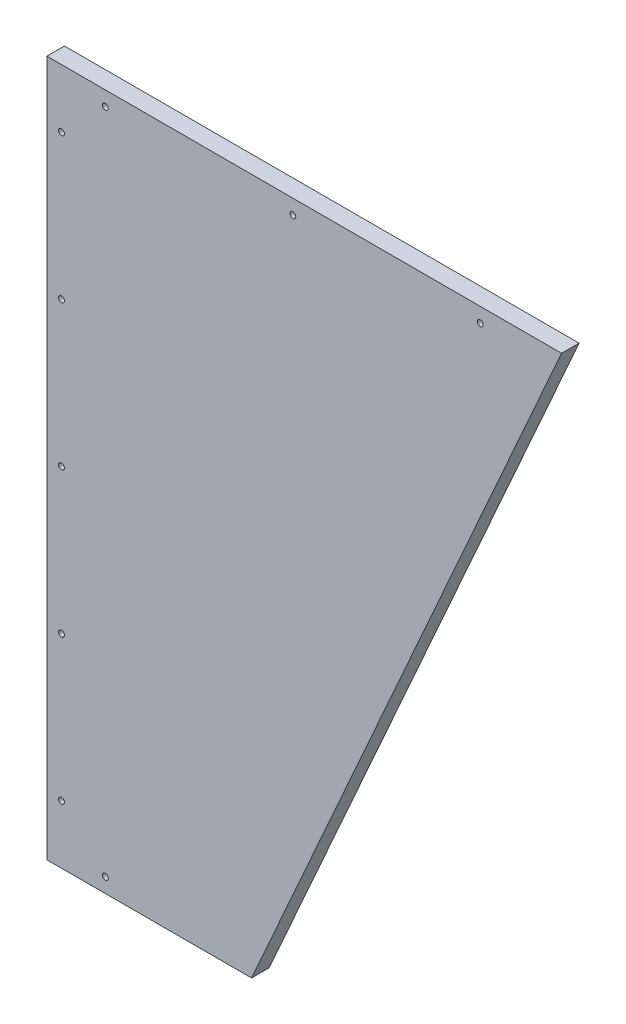
from build123d import *

# Parameters (mm, degrees)
EXTRUDE_1_DEPTH     = 15
SKETCH_2_R          = 2.5
CUT_EXTRUDE_1_DEPTH = 371.312368143
SKETCH_2_3_R        = 2.5
CUT_EXTRUDE_2_DEPTH = 371.312368143


with BuildPart() as part:
    # ｽｹｯﾁ1 → ﾎﾞｽ - 押し出し1 (new body)
    with BuildSketch(Plane.XY):
        Polygon((-220, 297.5), (220, 297.5), (-45, -297.5), (-220, -297.5), align=None)
    extrude(amount=EXTRUDE_1_DEPTH)

    # ｽｹｯﾁ2 → ｶｯﾄ - 押し出し1 (cut, through all)
    with BuildSketch(Plane.XY.offset(15)):
        with Locations((-170, 285)):
            Circle(SKETCH_2_R)
        with Locations((-9.725, 285)):
            Circle(SKETCH_2_R)
        with Locations((150.55, 285)):
            Circle(SKETCH_2_R)
    cut_extrude_1 = extrude(amount=-CUT_EXTRUDE_1_DEPTH, mode=Mode.SUBTRACT)

    # ｽｹｯﾁ2<3> → ｶｯﾄ - 押し出し2 (cut, through all)
    with BuildSketch(Plane.XY.offset(15)):
        with Locations((-207.5, 247.5)):
            Circle(SKETCH_2_3_R)
        with Locations((-207.5, 123.75)):
            Circle(SKETCH_2_3_R)
        with Locations((-207.5, 0)):
            Circle(SKETCH_2_3_R)
        with Locations((-207.5, -123.75)):
            Circle(SKETCH_2_3_R)
        with Locations((-207.5, -247.5)):
            Circle(SKETCH_2_3_R)
    extrude(amount=-CUT_EXTRUDE_2_DEPTH, mode=Mode.SUBTRACT)

    # ﾐﾗｰ1: ｶｯﾄ - 押し出し1 across plane
    add(cut_extrude_1.mirror(Plane.ZX), mode=Mode.SUBTRACT)


solid = part.part
